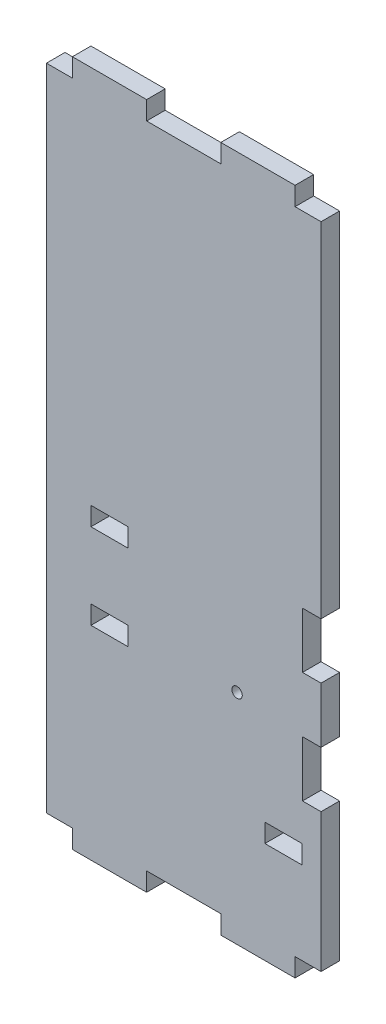
from build123d import *

# Parameters (mm, degrees)
BOSS_EXTRUDE1_DEPTH = 6.35
SKETCH2_W           = 6.35
SKETCH2_H           = 19.05
SKETCH2_W_2         = 12.7
SKETCH2_H_2         = 6.35
SKETCH2_R           = 1.778
CUT_EXTRUDE1_DEPTH  = 127.683693603


with BuildPart() as part:
    # Sketch1 → Boss-Extrude1 (new body)
    with BuildSketch(Plane.XY):
        Polygon((-46.99, 111.125), (-38.1, 111.125), (-38.1, 117.475), (-12.7, 117.475), (-12.7, 111.125), (12.7, 111.125), (12.7, 117.475), (38.1, 117.475), (38.1, 111.125), (46.99, 111.125), (46.99, -111.125), (38.1, -111.125), (38.1, -117.475), (12.7, -117.475), (12.7, -111.125), (-12.7, -111.125), (-12.7, -117.475), (-38.1, -117.475), (-38.1, -111.125), (-46.99, -111.125), align=None)
    extrude(amount=BOSS_EXTRUDE1_DEPTH)

    # Sketch2 → Cut-Extrude1 (cut, through all)
    with BuildSketch(Plane(origin=(0, 0, 0), x_dir=(-1, 0, 0), z_dir=(0, 0, -1))):
        with Locations((-43.815, -54.2076454)):
            Rectangle(SKETCH2_W, SKETCH2_H)
        with Locations((-43.815, -16.1076454)):
            Rectangle(SKETCH2_W, SKETCH2_H)
        with Locations((-34.13125, -79.6076454)):
            Rectangle(SKETCH2_W_2, SKETCH2_H_2)
        with Locations((25.4, -15.485506714)):
            Rectangle(SKETCH2_W_2, SKETCH2_H_2)
        with Locations((25.4, -44.695506714)):
            Rectangle(SKETCH2_W_2, SKETCH2_H_2)
        with Locations((-18.25625, -42.753213284)):
            Circle(SKETCH2_R)
    extrude(amount=-CUT_EXTRUDE1_DEPTH, mode=Mode.SUBTRACT)


solid = part.part
